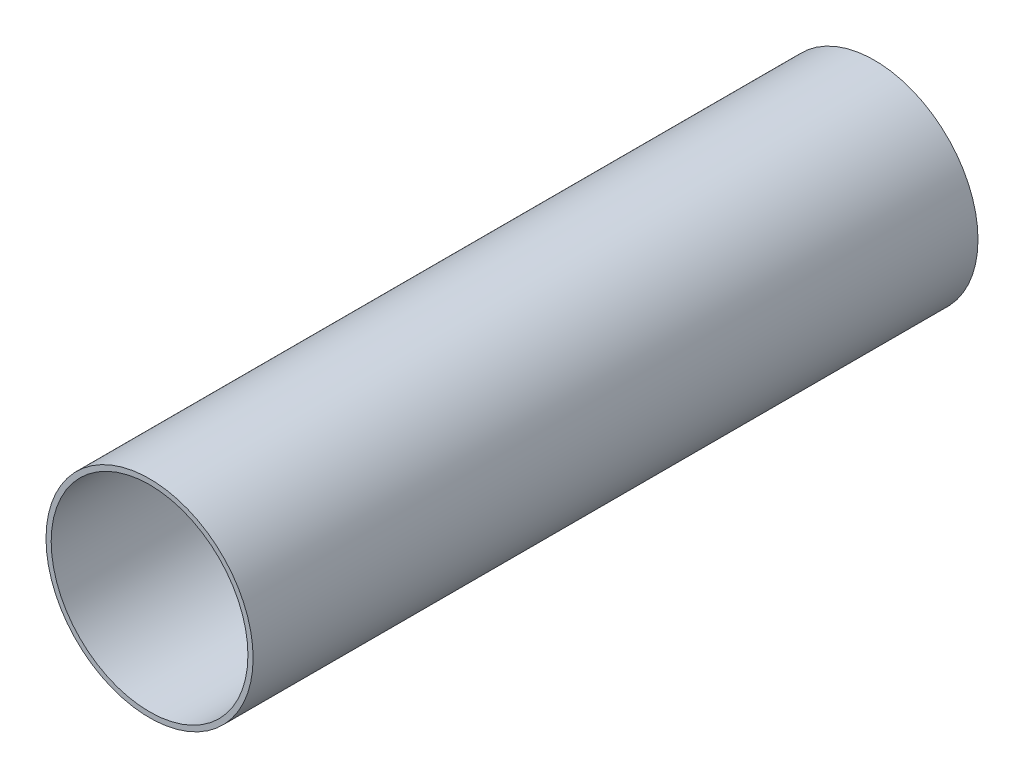
from build123d import *

# Parameters (mm, degrees)
SKETCH1_R           = 10
SKETCH1_R_2         = 9.5
BOSS_EXTRUDE1_DEPTH = 70


with BuildPart() as part:
    # Sketch1 → Boss-Extrude1 (new body)
    with BuildSketch(Plane.XY):
        Circle(SKETCH1_R)
        Circle(SKETCH1_R_2, mode=Mode.SUBTRACT)
    extrude(amount=BOSS_EXTRUDE1_DEPTH)


solid = part.part
